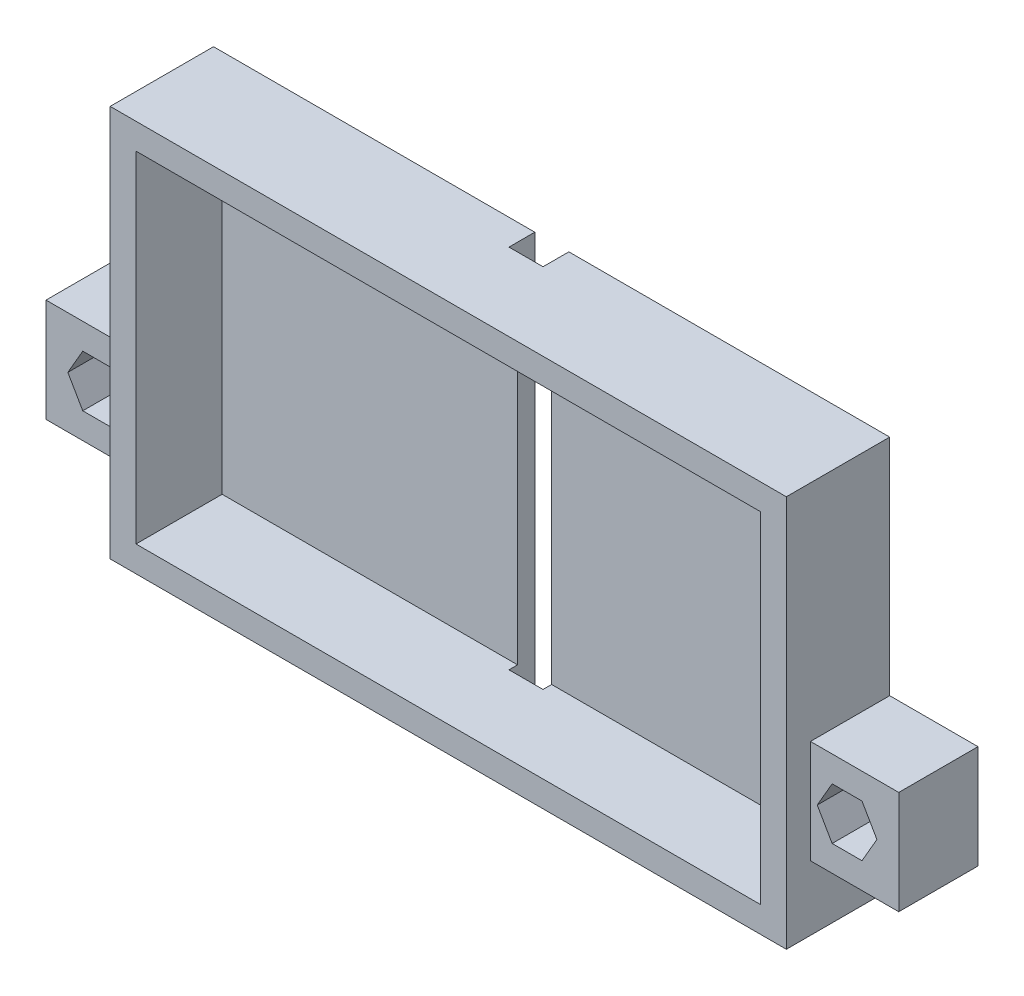
from build123d import *

# Parameters (mm, degrees)
ESBO_O1_W                 = 72.5
ESBO_O1_H                 = 39.5
RESSALTO_EXTRUS_O1_DEPTH  = 2
ESBO_O1_3_W               = 78.5
ESBO_O1_3_H               = 45.5
ESBO_O1_3_W_2             = 72.5
ESBO_O1_3_H_2             = 39.5
RESSALTO_EXTRUS_O2_DEPTH  = 12
ESBO_O1_4_W               = 10.25
ESBO_O1_4_H               = 12
ESBO_O1_4_R               = 1.6
RESSALTO_EXTRUS_O3_DEPTH  = 6
ESBO_O3_W                 = 9.7
ESBO_O3_H                 = 3.2
RESSALTO_EXTRUS_O4_DEPTH  = 3.5
ESBO_O5_W                 = 3.952514159
ESBO_O5_H                 = 45.5
CORTE_EXTRUS_O4_DEPTH     = 3
RESSALTO_EXTRUS_O5_DEPTH  = 9.7
RESSALTO_EXTRUS_O6_DEPTH  = 9.7
ESBO_O9_W                 = 79.78598512
ESBO_O9_H                 = 21.194293461
CORTE_EXTRUS_O5_DEPTH     = 10
ESBO_O11_W                = 10.25
ESBO_O11_H                = 12
RESSALTO_EXTRUS_O8_DEPTH  = 1.2
ESBO_O12_R                = 1.6
CORTE_EXTRUS_O6_DEPTH     = 99.200369144
CORTE_EXTRUS_O7_START     = -3.75
ESBO_O13_R                = 1.6
CORTE_EXTRUS_O7_DEPTH     = 3.75
ESBO_O14_W                = 10.25
ESBO_O14_H                = 12
RESSALTO_EXTRUS_O10_DEPTH = 2


with BuildPart() as part:
    # Esboço1 → Ressalto-extrusão1 (new body)
    with BuildSketch(Plane.XY):
        with Locations((-36.25, 19.75)):
            Rectangle(ESBO_O1_W, ESBO_O1_H)
    extrude(amount=RESSALTO_EXTRUS_O1_DEPTH)

    # Esboço1<3> → Ressalto-extrusão2 (add)
    with BuildSketch(Plane.XY):
        with Locations((-36.25, 19.75)):
            Rectangle(ESBO_O1_3_W, ESBO_O1_3_H)
        with Locations((-36.25, 19.75)):
            Rectangle(ESBO_O1_3_W_2, ESBO_O1_3_H_2, mode=Mode.SUBTRACT)
    extrude(amount=RESSALTO_EXTRUS_O2_DEPTH)

    # Esboço1<4> → Ressalto-extrusão3 (add)
    # profile 1 of 2: a face of its own
    with BuildSketch(Plane.XY):
        with Locations((-80.625, 10.5)):
            Rectangle(ESBO_O1_4_W, ESBO_O1_4_H)
        with Locations((-79.75, 10.5)):
            Circle(ESBO_O1_4_R, mode=Mode.SUBTRACT)
    # profile 2 of 2: a face of its own
    with BuildSketch(Plane.XY):
        with Locations((8.125, 10.5)):
            Rectangle(ESBO_O1_4_W, ESBO_O1_4_H)
        with Locations((7.25, 10.5)):
            Circle(ESBO_O1_4_R, mode=Mode.SUBTRACT)
    extrude(amount=RESSALTO_EXTRUS_O3_DEPTH)

    # Esboço3 → Ressalto-extrusão4 (add)
    with BuildSketch(Plane(origin=(0, 0, 0), x_dir=(-1, 0, 0), z_dir=(0, 0, -1))):
        with Locations((63.4, 24.1)):
            Rectangle(ESBO_O3_W, ESBO_O3_H)
        with Locations((9.1, 24.1)):
            Rectangle(ESBO_O3_W, ESBO_O3_H)
    extrude(amount=RESSALTO_EXTRUS_O4_DEPTH)

    # Esboço5 → Corte-extrusão4 (cut)
    with BuildSketch(Plane(origin=(0, 0, 0), x_dir=(-1, 0, 0), z_dir=(0, 0, -1))):
        with Locations((36.22625708, 19.75)):
            Rectangle(ESBO_O5_W, ESBO_O5_H)
    extrude(amount=-CORTE_EXTRUS_O4_DEPTH, mode=Mode.SUBTRACT)

    # Esboço7 → Ressalto-extrusão5 (add)
    with BuildSketch(Plane(origin=(-58.55, 0, 0), x_dir=(0, 0, -1), z_dir=(1, 0, 0))):
        Polygon((3.5, 25.7), (3.5, 26.2), (4.5, 25.7), (3.5, 22.5), align=None)
    extrude(amount=-RESSALTO_EXTRUS_O5_DEPTH)

    # Esboço8 → Ressalto-extrusão6 (add)
    with BuildSketch(Plane(origin=(-4.25, 0, 0), x_dir=(0, 0, -1), z_dir=(1, 0, 0))):
        Polygon((3.5, 25.7), (3.5, 26.2), (4.5, 25.7), (3.5, 22.5), align=None)
    extrude(amount=-RESSALTO_EXTRUS_O6_DEPTH)

    # Esboço9 → Corte-extrusão5 (cut)
    with BuildSketch(Plane(origin=(0, 0, -10), x_dir=(-1, 0, 0), z_dir=(0, 0, -1))):
        with Locations((37.346022271, 20.867499613)):
            Rectangle(ESBO_O9_W, ESBO_O9_H)
    extrude(amount=-CORTE_EXTRUS_O5_DEPTH, mode=Mode.SUBTRACT)

    # Esboço11 → Ressalto-extrusão8 (add)
    with BuildSketch(Plane.XY.offset(6)):
        with Locations((8.125, 10.5)):
            Rectangle(ESBO_O11_W, ESBO_O11_H)
        with Locations((-80.625, 10.5)):
            Rectangle(ESBO_O11_W, ESBO_O11_H)
    extrude(amount=RESSALTO_EXTRUS_O8_DEPTH)

    # Esboço12 → Corte-extrusão6 (cut, through all)
    with BuildSketch(Plane(origin=(0, 0, -10), x_dir=(-1, 0, 0), z_dir=(0, 0, -1))):
        with Locations(Location((-7.25, 10.5, 0), (0, 0, 180))):
            Circle(ESBO_O12_R)
        with Locations(Location((79.75, 10.5, 0), (0, 0, 180))):
            Circle(ESBO_O12_R)
    extrude(amount=-CORTE_EXTRUS_O6_DEPTH, mode=Mode.SUBTRACT)

    # Esboço13 → Corte-extrusão7 (cut)
    # profile 1 of 2: a face of its own
    with BuildSketch(Plane.XY.offset(7.2).offset(CORTE_EXTRUS_O7_START)):
        Polygon((-83.214101615, 10.5), (-81.482050808, 7.5), (-78.017949192, 7.5), (-76.285898385, 10.5), (-78.017949192, 13.5), (-81.482050808, 13.5), align=None)
        with Locations((-79.75, 10.5)):
            Circle(ESBO_O13_R, mode=Mode.SUBTRACT)
    # profile 2 of 2: a face of its own
    with BuildSketch(Plane.XY.offset(7.2).offset(CORTE_EXTRUS_O7_START)):
        Polygon((10.714101615, 10.5), (8.982050808, 13.5), (5.517949192, 13.5), (3.785898385, 10.5), (5.517949192, 7.5), (8.982050808, 7.5), align=None)
        with Locations((7.25, 10.5)):
            Circle(ESBO_O13_R, mode=Mode.SUBTRACT)
    extrude(amount=CORTE_EXTRUS_O7_DEPTH, mode=Mode.SUBTRACT)

    # Esboço14 → Ressalto-extrusão10 (add)
    # profile 1 of 2: a face of its own
    with BuildSketch(Plane.XY.offset(7.2)):
        with Locations((8.125, 10.5)):
            Rectangle(ESBO_O14_W, ESBO_O14_H)
        Polygon((8.982050808, 7.5), (10.714101615, 10.5), (8.982050808, 13.5), (5.517949192, 13.5), (3.785898385, 10.5), (5.517949192, 7.5), align=None, mode=Mode.SUBTRACT)
    # profile 2 of 2: a face of its own
    with BuildSketch(Plane.XY.offset(7.2)):
        with Locations((-80.625, 10.5)):
            Rectangle(ESBO_O14_W, ESBO_O14_H)
        Polygon((-81.482050808, 13.5), (-83.214101615, 10.5), (-81.482050808, 7.5), (-78.017949192, 7.5), (-76.285898385, 10.5), (-78.017949192, 13.5), align=None, mode=Mode.SUBTRACT)
    extrude(amount=RESSALTO_EXTRUS_O10_DEPTH)


solid = part.part
